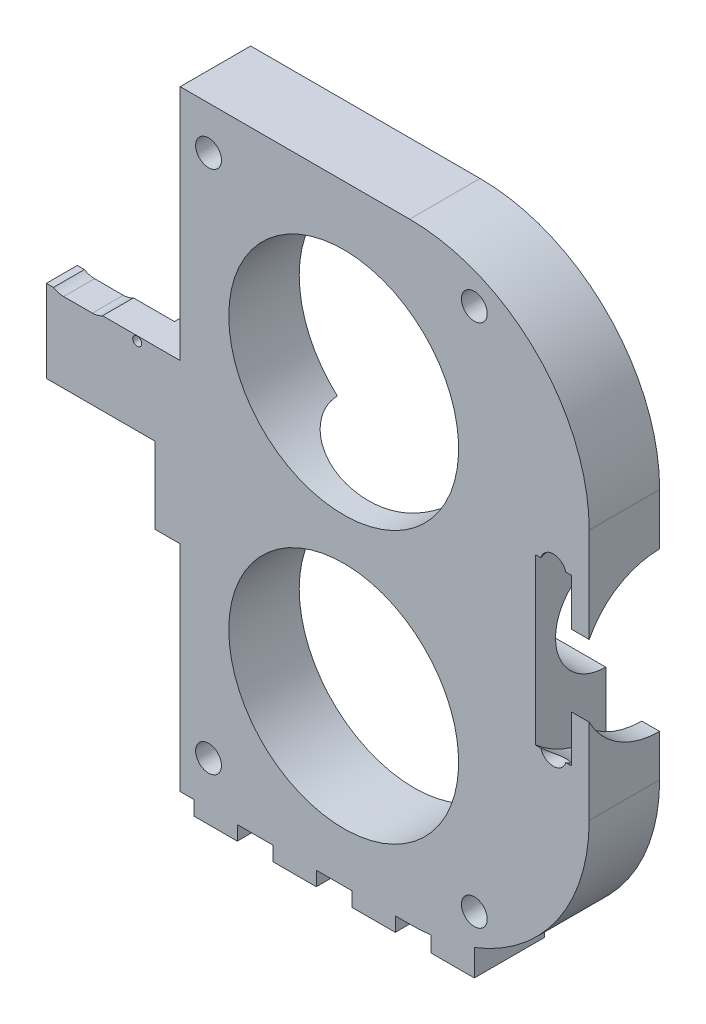
from build123d import *

# Parameters (mm, degrees)
MAIN_BODY_DEPTH                                      = 16
FLYWHEEL_ESC_CLEARANCE_DEPTH                         = 10
FLYWHEEL_ESC_WIRE_DEPTH                              = 5
DRIVE_STEPPER_CLEARANCE_DEPTH                        = 13
DRIVE_BELT_CLEARANCE_DEPTH                           = 4
CLIP_CLEARANCE_DEPTH                                 = 40.5
CLIP_HEAD_CLEARANCE_DEPTH                            = 13
SKETCH16_R                                           = 16
FLYWHEEL_CLEARANCE_DEPTH                             = 10
SKETCH17_W                                           = 12
SKETCH17_H                                           = 10
CUT_EXTRUDE17_DEPTH                                  = 83
M3_TAPPED_HOLE1_D                                    = 2.5
M3_TAPPED_HOLE1_DEPTH                                = 7.5
M3_TAPPED_HOLE1_TIP                                  = 0.751075774
CBORE_FOR_M3_HEX_SOCKET_THIN_HEAD_CAP_SC_D           = 3.6
CBORE_FOR_M3_HEX_SOCKET_THIN_HEAD_CAP_SC_CBORE_D     = 6.5
CBORE_FOR_M3_HEX_SOCKET_THIN_HEAD_CAP_SC_CBORE_DEPTH = 3
FILLET1_R                                            = 7
CUT_EXTRUDE19_DEPTH                                  = 3.5
M1_6_TAPPED_HOLE1_D                                  = 1.25
M1_6_TAPPED_HOLE1_DEPTH                              = 5
M1_6_TAPPED_HOLE1_TIP                                = 0.375537887
CUT_EXTRUDE20_REACH                                  = 159.875
VARFILLET1_R                                         = 1
CUT_EXTRUDE21_DEPTH                                  = 1.5
SKETCH29_W                                           = 51.659518048
SKETCH29_H                                           = 2.245304486
BOSS_EXTRUDE1_DEPTH                                  = 1
CUT_EXTRUDE22_START                                  = -16
CUT_EXTRUDE22_DEPTH                                  = 16
CUT_EXTRUDE23_START                                  = -75.58451
SKETCH32_W                                           = 7.763871227
SKETCH32_H                                           = 95.016791683
CUT_EXTRUDE23_DEPTH                                  = 75.58451


with BuildPart() as part:
    # Sketch1 → main body (new body)
    with BuildSketch(Plane.XY):
        with BuildLine():
            Line((84.634238464, 37.676192421), (84.634238464, 34))
            Line((84.634238464, 34), (78.634238464, 34))
            Line((78.634238464, 34), (78.634238464, 36.180652708))
            ThreePointArc((78.634238464, 36.180652708), (77.13695562, 36.045204045), (75.634238464, 36))
            Line((75.634238464, 36), (73.634238464, 36))
            Line((73.634238464, 36), (73.634238464, 34))
            Line((73.634238464, 34), (67.634238464, 34))
            Line((67.634238464, 34), (67.634238464, 36))
            Line((67.634238464, 36), (62.634238464, 36))
            Line((62.634238464, 36), (62.634238464, 34))
            Line((62.634238464, 34), (56.634238464, 34))
            Line((56.634238464, 34), (56.634238464, 36))
            Line((56.634238464, 36), (51.634238464, 36))
            Line((51.634238464, 36), (51.634238464, 34))
            Line((51.634238464, 34), (45.634238464, 34))
            Line((45.634238464, 34), (45.634238464, 36))
            Line((45.634238464, 36), (40.177209114, 36))
            Line((40.177209114, 36), (-54.822790886, 36))
            Line((-54.822790886, 36), (-54.822790886, 119))
            Line((-54.822790886, 119), (-42.822790886, 119))
            Line((-42.822790886, 119), (-42.822790886, 121))
            Line((-42.822790886, 121), (75.634238464, 121))
            ThreePointArc((75.634238464, 121), (93.311907994, 113.67766953), (100.634238464, 96))
            Line((100.634238464, 96), (100.634238464, 61))
            ThreePointArc((100.634238464, 61), (96.249766592, 46.857864376), (84.634238464, 37.676192421))
        make_face()
    extrude(amount=MAIN_BODY_DEPTH)

    # Sketch2 → flywheel_esc_clearance (cut)
    with BuildSketch(Plane(origin=(0, 0, 0), x_dir=(-1, 0, 0), z_dir=(0, 0, -1))):
        Polygon((-7.21561795, 116.504695514), (-10.21561795, 116.504695514), (-10.21561795, 118.754695514), (-13.21561795, 118.754695514), (-10.970313465, 121), (-12.384527027, 121), (-14.629831513, 118.754695514), (-18.21561795, 118.754695514), (-15.970313465, 121), (-17.384527027, 121), (-19.629831513, 118.754695514), (-23.21561795, 118.754695514), (-20.970313465, 121), (-22.384527027, 121), (-24.629831513, 118.754695514), (-28.21561795, 118.754695514), (-25.970313465, 121), (-27.384527027, 121), (-29.629831513, 118.754695514), (-33.21561795, 118.754695514), (-30.970313465, 121), (-32.384527027, 121), (-34.629831513, 118.754695514), (-35.21561795, 118.754695514), (-35.21561795, 116.504695514), (-37.71561795, 116.504695514), (-37.71561795, 114.004695514), (-35.21561795, 114.004695514), (-35.21561795, 111.754695514), (-14.71561795, 111.754695514), (-14.71561795, 109.254695514), (-10.21561795, 109.254695514), (-10.21561795, 111.047588733), (-10.21561795, 114.004695514), (-7.21561795, 114.004695514), (-7.21561795, 111.047588733), (-7.21561795, 109.254695514), (-2.71561795, 109.254695514), (-2.71561795, 111.754695514), (17.78438205, 111.754695514), (17.78438205, 114.004695514), (20.28438205, 114.004695514), (20.28438205, 116.504695514), (17.78438205, 116.504695514), (17.78438205, 118.754695514), (14.78438205, 118.754695514), (17.029686535, 121), (15.615472973, 121), (13.370168487, 118.754695514), (9.78438205, 118.754695514), (12.029686535, 121), (10.615472973, 121), (8.370168487, 118.754695514), (4.78438205, 118.754695514), (7.029686535, 121), (5.615472973, 121), (3.370168487, 118.754695514), (-0.21561795, 118.754695514), (2.029686535, 121), (0.615472973, 121), (-1.629831513, 118.754695514), (-5.21561795, 118.754695514), (-2.970313465, 121), (-4.384527027, 121), (-6.629831513, 118.754695514), (-7.21561795, 118.754695514), align=None)
    extrude(amount=-FLYWHEEL_ESC_CLEARANCE_DEPTH, mode=Mode.SUBTRACT)

    # Sketch4 → Flywheel_esc_wire (cut)
    with BuildSketch(Plane(origin=(0, 0, 0), x_dir=(-1, 0, 0), z_dir=(0, 0, -1))):
        Polygon((27.259258709, 111.754695514), (42.822790886, 111.754695514), (42.822790886, 117.754695514), (17.78438205, 117.754695514), (17.78438205, 111.754695514), (-35.21561795, 111.754695514), (-35.21561795, 118.754695514), (-38.21561795, 118.754695514), (-38.21561795, 108.754695514), (27.259258709, 108.754695514), align=None)
    extrude(amount=-FLYWHEEL_ESC_WIRE_DEPTH, mode=Mode.SUBTRACT)

    # Sketch6 → drive_Stepper_clearance (cut)
    with BuildSketch(Plane(origin=(0, 0, 0), x_dir=(-1, 0, 0), z_dir=(0, 0, -1))):
        with BuildLine():
            Line((41.822790886, 108.33001947), (54.822790886, 108.33001947))
            Line((54.822790886, 108.33001947), (54.822790886, 72.33001947))
            Line((54.822790886, 72.33001947), (41.822790886, 72.33001947))
            ThreePointArc((41.822790886, 72.33001947), (39.701470543, 73.208699126), (38.822790886, 75.33001947))
            Line((38.822790886, 75.33001947), (38.822790886, 105.33001947))
            ThreePointArc((38.822790886, 105.33001947), (39.701470543, 107.451339814), (41.822790886, 108.33001947))
        make_face()
    extrude(amount=-DRIVE_STEPPER_CLEARANCE_DEPTH, mode=Mode.SUBTRACT)

    # Sketch7 → drive_belt_clearance (cut)
    with BuildSketch(Plane(origin=(0, 0, 0), x_dir=(-1, 0, 0), z_dir=(0, 0, -1))):
        with BuildLine():
            Line((-31.457904234, 82.83), (38.822790886, 82.83))
            Line((38.822790886, 82.83), (38.822790886, 97.83))
            Line((38.822790886, 97.83), (-31.457904234, 97.83))
            ThreePointArc((-31.457904234, 97.83), (-38.957904234, 90.33), (-31.457904234, 82.83))
        make_face()
    extrude(amount=-DRIVE_BELT_CLEARANCE_DEPTH, mode=Mode.SUBTRACT)

    # Sketch12 → barrel (revolve, cut)
    with BuildSketch(Plane(origin=(0, 0, 0), x_dir=(-1, 0, 0), z_dir=(0, 0, -1))):
        Polygon((-100.634238464, 88.83), (-98.134238464, 88.83), (-98.134238464, 92.93), (-93.134238464, 92.93), (-93.134238464, 84.83), (-44.977209114, 84.83), (-27.977209114, 86.83), (38.822790886, 86.83), (38.822790886, 77.83), (-93.134238464, 77.83), (-100.634238464, 77.83), align=None)
    revolve(axis=Axis((100.634238464, 77.83, 0), (-1, 0, 0)), mode=Mode.SUBTRACT)

    # Sketch14 → clip clearance (cut)
    with BuildSketch(Plane.XZ.offset(-36)):
        Polygon((40.177209114, 9.807012356), (40.177209114, 0), (-41.822790886, 0), (-41.822790886, 9.807012356), (-31.822790886, 11.340345689), (-31.822790886, 10.733333333), (-30.222790886, 10.978666667), (-30.222790886, 11.585679022), (-28.820032834, 11.80076859), (-28.820032834, 9.5), (-24.320032834, 9.5), (-24.320032834, 14), (-13.422790886, 14), (-13.422790886, 13), (-11.822790886, 13), (-11.822790886, 14), (10.177209114, 14), (10.177209114, 13), (11.777209114, 13), (11.777209114, 14), (25.177209114, 14), (25.177209114, 12.107012356), (28.577209114, 11.585679022), (28.577209114, 10.978666667), (30.177209114, 10.733333333), (30.177209114, 11.340345689), align=None)
    extrude(amount=-CLIP_CLEARANCE_DEPTH, mode=Mode.SUBTRACT)

    # Sketch15 → clip-head clearance (cut)
    with BuildSketch(Plane.XZ.offset(-76.5)):
        Polygon((-24.320032834, 0), (-24.320032834, 14), (-13.422790886, 14), (-13.422790886, 13), (-11.822790886, 13), (-11.822790886, 14), (10.177209114, 14), (10.177209114, 13), (11.777209114, 13), (11.777209114, 14), (22.464967166, 14), (22.464967166, 0), align=None)
    extrude(amount=-CLIP_HEAD_CLEARANCE_DEPTH, mode=Mode.SUBTRACT)

    # Sketch16 → flywheel_clearance (cut)
    with BuildSketch(Plane(origin=(0, 0, 0), x_dir=(-1, 0, 0), z_dir=(0, 0, -1))):
        with Locations((-66.450434282, 96.74)):
            Circle(SKETCH16_R)
        with Locations((-66.450434282, 58.92)):
            Circle(SKETCH16_R)
    extrude(amount=-FLYWHEEL_CLEARANCE_DEPTH, mode=Mode.SUBTRACT)

    # Sketch17 → Cut-Extrude17 (cut)
    with BuildSketch(Plane(origin=(0, 119, 0), x_dir=(1, 0, 0), z_dir=(0, 1, 0))):
        with Locations((-48.822790886, -5)):
            Rectangle(SKETCH17_W, SKETCH17_H)
    extrude(amount=-CUT_EXTRUDE17_DEPTH, mode=Mode.SUBTRACT)

    # M3 Tapped Hole1
    with Locations(Plane(origin=(0, 36, 0), x_dir=(-1, 0, 0), z_dir=(0, -1, 0))):
        with Locations((44.822790886, -12.5), (-41.677209114, -12.5)):
            Hole(M3_TAPPED_HOLE1_D / 2, depth=M3_TAPPED_HOLE1_DEPTH)
            with Locations((0, 0, -(M3_TAPPED_HOLE1_DEPTH + M3_TAPPED_HOLE1_TIP / 2))):  # 118° drill point
                Cone(0, M3_TAPPED_HOLE1_D / 2, M3_TAPPED_HOLE1_TIP, mode=Mode.SUBTRACT)

    # CBORE for M3 Hex Socket Thin Head Cap Screw1 (through all)
    with Locations(Plane.XY.offset(16)):
        with Locations((95.634238464, 88.83), (95.634238464, 66.83), (84.634238464, 115), (47.634238464, 115), (47.634238464, 42), (84.634238464, 42), (-48.822790886, 44.50734437), (-48.822790886, 64.952229105), (-48.822790886, 115)):
            CounterBoreHole(CBORE_FOR_M3_HEX_SOCKET_THIN_HEAD_CAP_SC_D / 2, CBORE_FOR_M3_HEX_SOCKET_THIN_HEAD_CAP_SC_CBORE_D / 2, CBORE_FOR_M3_HEX_SOCKET_THIN_HEAD_CAP_SC_CBORE_DEPTH)

    # Fillet1
    fillet1_edges = [part.edges().sort_by_distance(p)[0] for p in [
        (-0.822790886, 89.5, 14),
    ]]
    fillet(fillet1_edges, radius=FILLET1_R)

    # Sketch23 → Cut-Extrude19 (cut)
    with BuildSketch(Plane.XY.offset(16)):
        with BuildLine():
            Line((16.157904234, 96.58), (31.457904234, 96.58))
            ThreePointArc((31.457904234, 96.58), (35.564181233, 95.041792569), (37.649240377, 91.184316547))
            ThreePointArc((37.649240377, 91.184316547), (37.882767002, 90.752279232), (38.342670026, 90.58))
            Line((38.342670026, 90.58), (43.040307117, 90.58))
            ThreePointArc((43.040307117, 90.58), (43.535281864, 90.374974747), (43.740307117, 89.88))
            Line((43.740307117, 89.88), (43.740307117, 84.78))
            ThreePointArc((43.740307117, 84.78), (43.535281864, 84.285025253), (43.040307117, 84.08))
            Line((43.040307117, 84.08), (27.457904234, 84.08))
            ThreePointArc((27.457904234, 84.08), (23.351627235, 85.618207431), (21.266568091, 89.475683453))
            ThreePointArc((21.266568091, 89.475683453), (21.033041467, 89.907720768), (20.573138443, 90.08))
            Line((20.573138443, 90.08), (16.157904234, 90.08))
            ThreePointArc((16.157904234, 90.08), (15.662929487, 90.285025253), (15.457904234, 90.78))
            Line((15.457904234, 90.78), (15.457904234, 95.88))
            ThreePointArc((15.457904234, 95.88), (15.662929487, 96.374974747), (16.157904234, 96.58))
        make_face()
    extrude(amount=-CUT_EXTRUDE19_DEPTH, mode=Mode.SUBTRACT)

    # M1.6 Tapped Hole1
    with Locations(Plane.XY.offset(12.5)):
        with Locations((21.212906236, 93.33), (37.702902233, 87.33)):
            Hole(M1_6_TAPPED_HOLE1_D / 2, depth=M1_6_TAPPED_HOLE1_DEPTH)
            with Locations((0, 0, -(M1_6_TAPPED_HOLE1_DEPTH + M1_6_TAPPED_HOLE1_TIP / 2))):  # 118° drill point
                Cone(0, M1_6_TAPPED_HOLE1_D / 2, M1_6_TAPPED_HOLE1_TIP, mode=Mode.SUBTRACT)

    # Sketch27 → Cut-Extrude20 (cut, up to next)
    with BuildSketch(Plane.XY.offset(12.5), mode=Mode.PRIVATE) as cut_extrude20_sk1:
        with BuildLine():
            Line((27.457904234, 87.58), (31.457904234, 87.58))
            ThreePointArc((31.457904234, 87.58), (34.207904234, 90.33), (31.457904234, 93.08))
            Line((31.457904234, 93.08), (27.457904234, 93.08))
            ThreePointArc((27.457904234, 93.08), (24.707904234, 90.33), (27.457904234, 87.58))
        make_face()
    cut_extrude20_tool1 = extrude(cut_extrude20_sk1.sketch, amount=-CUT_EXTRUDE20_REACH, mode=Mode.PRIVATE) & part.part
    add(cut_extrude20_tool1.solids().sort_by_distance((29.457904, 90.33, 12.5))[0], mode=Mode.SUBTRACT)

    # VarFillet1
    varfillet1_edges = [part.edges().sort_by_distance(p)[0] for p in [
        (24.707904234, 90.33, 12.5),
    ]]
    fillet(varfillet1_edges, radius=VARFILLET1_R)

    # Sketch28 → Cut-Extrude21 (cut)
    with BuildSketch(Plane(origin=(0, 0, 4), x_dir=(-1, 0, 0), z_dir=(0, 0, -1))):
        with BuildLine():
            Line((-27.457904234, 97.83), (-31.457904234, 97.83))
            ThreePointArc((-31.457904234, 97.83), (-38.957904234, 90.33), (-31.457904234, 82.83))
            Line((-31.457904234, 82.83), (-27.457904234, 82.83))
            ThreePointArc((-27.457904234, 82.83), (-19.957904234, 90.33), (-27.457904234, 97.83))
        make_face()
    extrude(amount=-CUT_EXTRUDE21_DEPTH, mode=Mode.SUBTRACT)

    # Sketch29 → Boss-Extrude1 (add)
    with BuildSketch(Plane(origin=(0, 0, 0), x_dir=(-1, 0, 0), z_dir=(0, 0, -1))):
        with Locations((-8.800072489, 119.877347757)):
            Rectangle(SKETCH29_W, SKETCH29_H)
    extrude(amount=-BOSS_EXTRUDE1_DEPTH)

    # Sketch30 → Cut-Extrude22 (cut)
    with BuildSketch(Plane(origin=(0, 0, 0), x_dir=(-1, 0, 0), z_dir=(0, 0, -1)).offset(CUT_EXTRUDE22_START)):
        Polygon((54.822790886, 99.517275915), (55.927668627, 99.517275915), (55.927668627, 124.750558425), (-43.686074091, 124.750558425), (-43.686074091, 99.517275915), (-43.686074091, 87.972636859), (-25.049728185, 87.972636859), (-25.049728185, 65.872899236), (-43.686074091, 65.872899236), (-43.686074091, 36), (-25.049728185, 36), (54.822790886, 36), align=None)
    extrude(amount=CUT_EXTRUDE22_DEPTH, mode=Mode.SUBTRACT)

    # Sketch32 → Cut-Extrude23 (cut)
    with BuildSketch(Plane.ZY.offset(-25.049728185).offset(CUT_EXTRUDE23_START)):
        with Locations((13.68894797, 76.395665261)):
            Rectangle(SKETCH32_W, SKETCH32_H)
    extrude(amount=CUT_EXTRUDE23_DEPTH, mode=Mode.SUBTRACT)


solid = part.part
